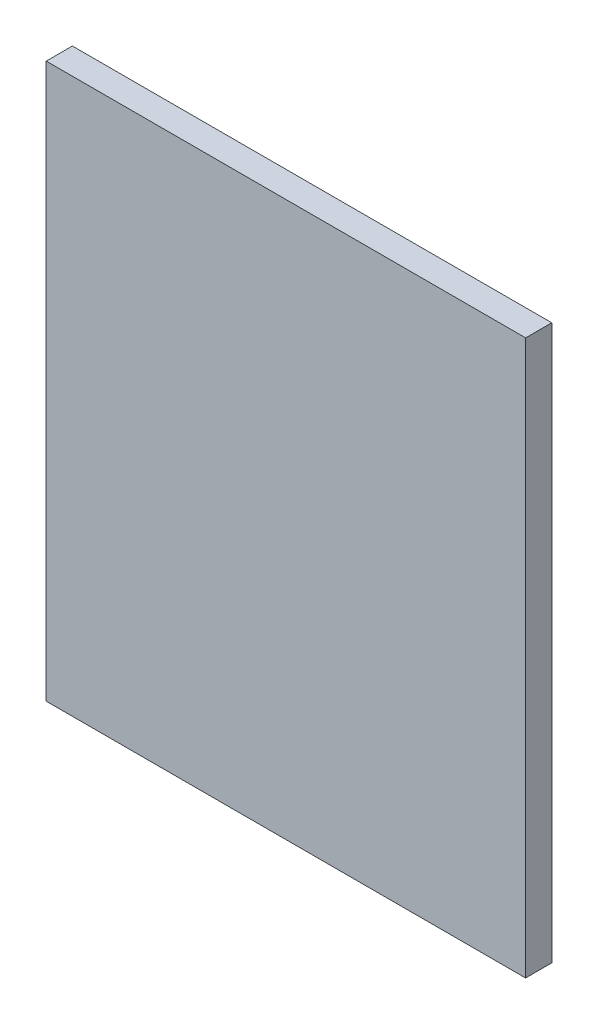
from build123d import *

# Parameters (mm, degrees)
ESQUISSE1_W        = 275
ESQUISSE1_H        = 318
BOSS_EXTRU_1_DEPTH = 15


with BuildPart() as part:
    # Esquisse1 → Boss.-Extru.1 (new body)
    with BuildSketch(Plane.XY):
        with Locations((137.5, 159)):
            Rectangle(ESQUISSE1_W, ESQUISSE1_H)
    extrude(amount=BOSS_EXTRU_1_DEPTH)


solid = part.part
